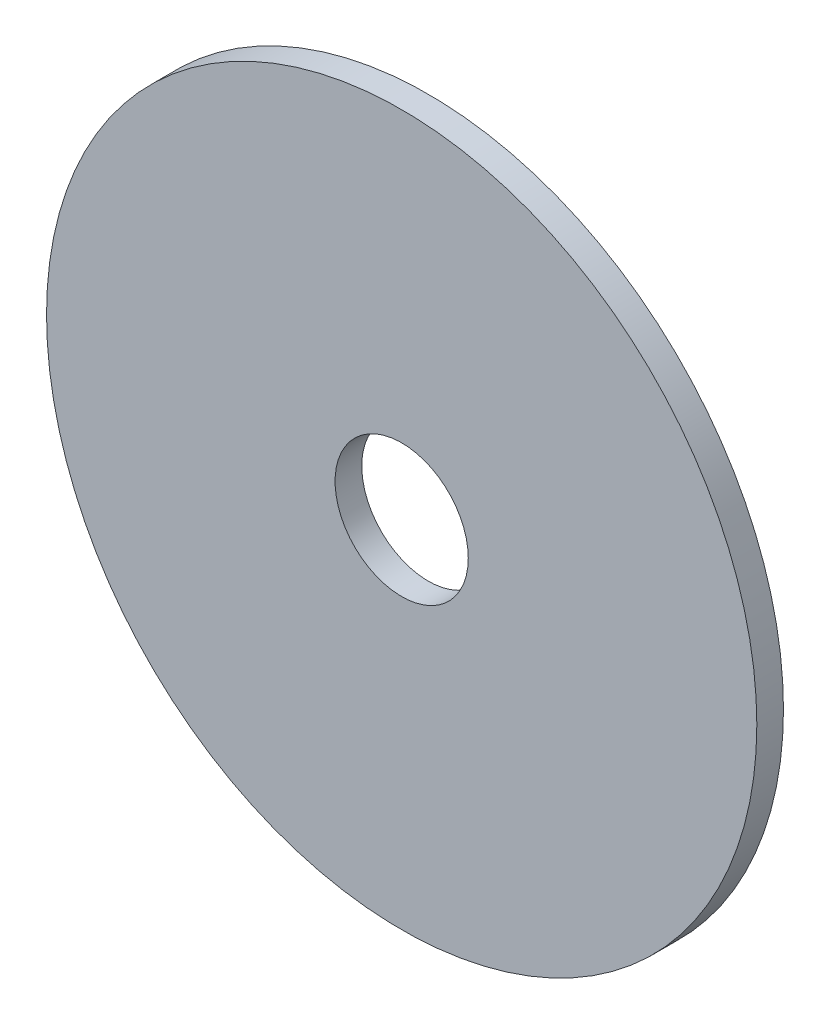
from build123d import *

# Parameters (mm, degrees)
SKETCH1_R           = 4
SKETCH1_R_2         = 0.75
BOSS_EXTRUDE1_DEPTH = 0.3


with BuildPart() as part:
    # Sketch1 → Boss-Extrude1 (new body)
    with BuildSketch(Plane.XY):
        Circle(SKETCH1_R)
        Circle(SKETCH1_R_2, mode=Mode.SUBTRACT)
    extrude(amount=BOSS_EXTRUDE1_DEPTH)


solid = part.part
